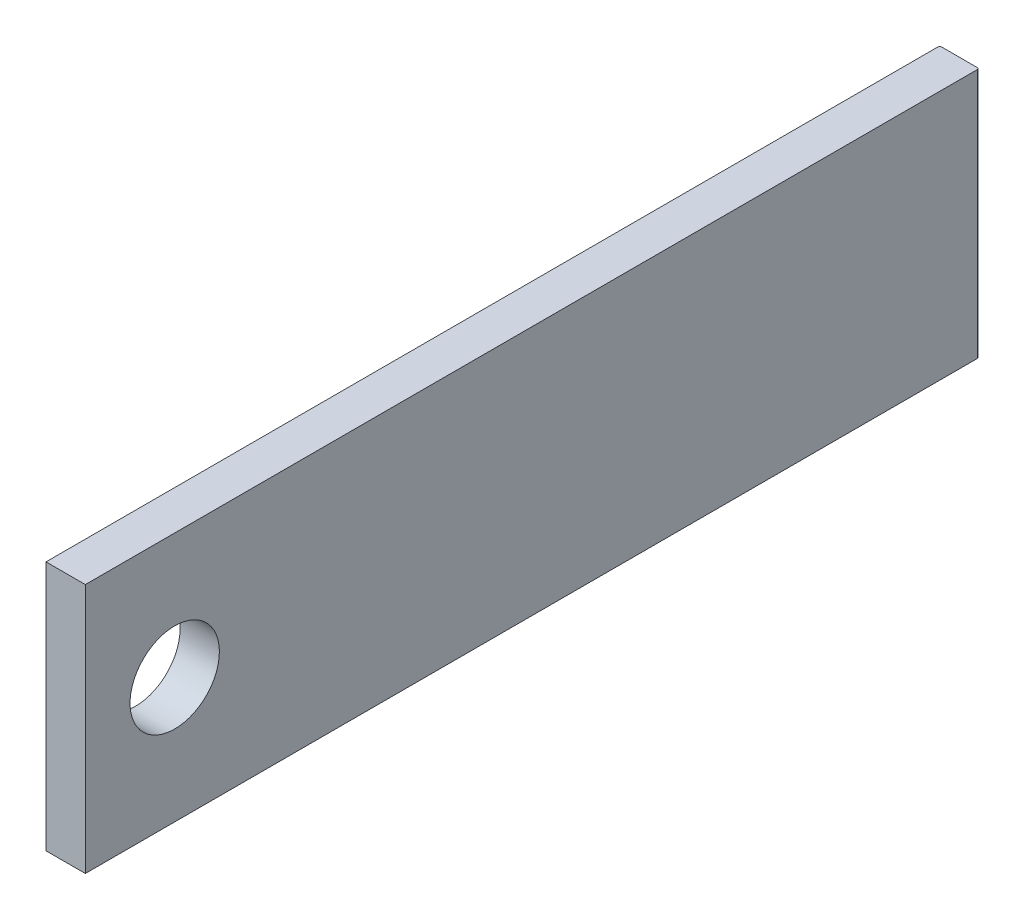
from build123d import *

# Parameters (mm, degrees)
SKETCH1_W           = 50
SKETCH1_H           = 14
BOSS_EXTRUDE1_DEPTH = 2.2
SKETCH2_R           = 2.5
CUT_EXTRUDE1_DEPTH  = 27.054558142
FILLET1_R           = 0.1
FILLET2_R           = 0.1


with BuildPart() as part:
    # Sketch1 → Boss-Extrude1 (new body)
    with BuildSketch(Plane(origin=(0, 0, 0), x_dir=(0, 0, -1), z_dir=(1, 0, 0))):
        Rectangle(SKETCH1_W, SKETCH1_H)
    extrude(amount=BOSS_EXTRUDE1_DEPTH)

    # Sketch2 → Cut-Extrude1 (cut, through all)
    with BuildSketch(Plane(origin=(2.2, 0, 0), x_dir=(0, 0, -1), z_dir=(1, 0, 0))):
        with Locations((-20, 0)):
            Circle(SKETCH2_R)
    extrude(amount=-CUT_EXTRUDE1_DEPTH, mode=Mode.SUBTRACT)

    # Fillet1
    fillet1_edges = [part.edges().sort_by_distance(p)[0] for p in [
        (2.2, 0, -25),
    ]]
    fillet(fillet1_edges, radius=FILLET1_R)

    # Fillet2
    fillet2_edges = [part.edges().sort_by_distance(p)[0] for p in [
        (0, 0, -25),
    ]]
    fillet(fillet2_edges, radius=FILLET2_R)


solid = part.part
